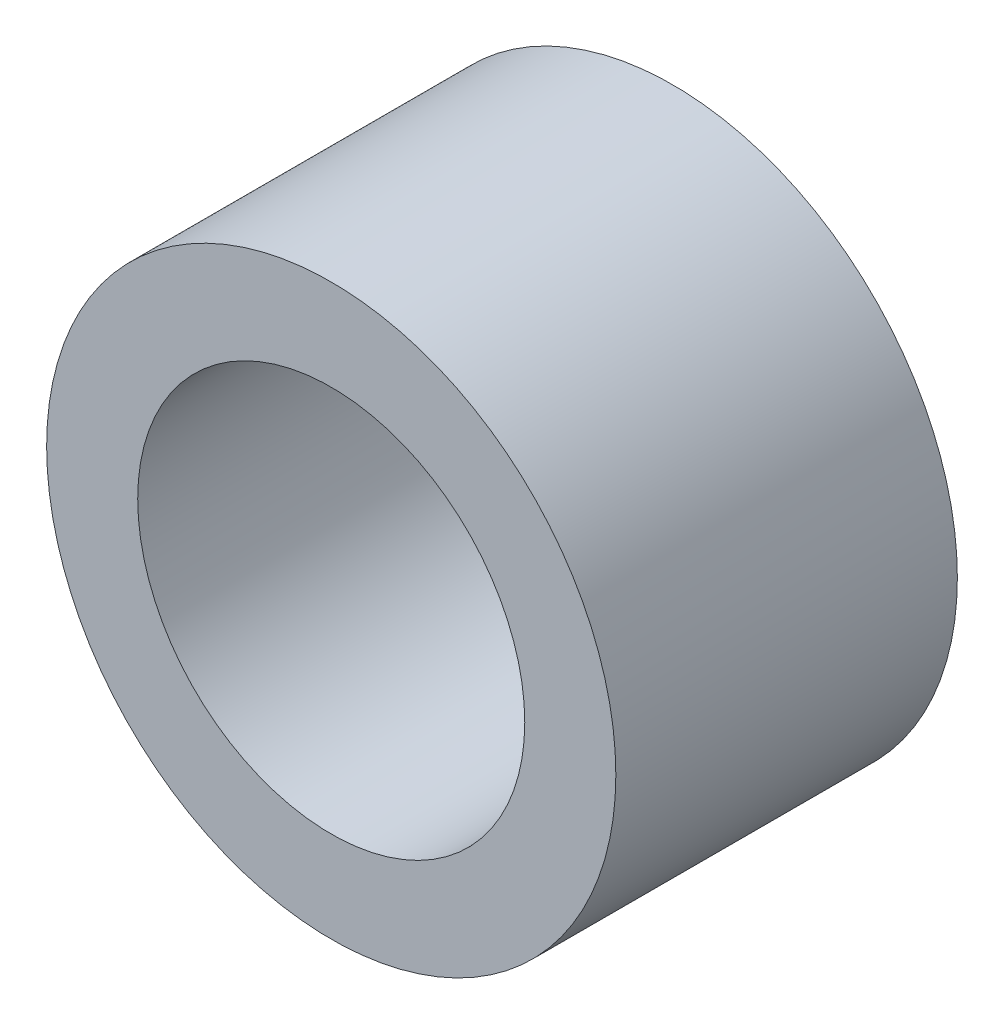
from build123d import *

# Parameters (mm, degrees)
SKETCH1_R               = 2.5
BOSS_EXTRUDE1_DEPTH     = 3
CUT_EXTRUDE1_DEPTH      = 5.636809248
CUT_EXTRUDE1_DEPTH_BACK = 5.636809248
SKETCH2_R               = 1.7


with BuildPart() as part:
    # Sketch1 → Boss-Extrude1 (new body)
    with BuildSketch(Plane(origin=(0, 0, 0), x_dir=(0, 1, 0), z_dir=(0, 0, 1))):
        with Locations(Location((0, 0, 0), (0, 0, 270))):
            Circle(SKETCH1_R)
    extrude(amount=BOSS_EXTRUDE1_DEPTH)

    # Sketch2 → Cut-Extrude1 (cut, two sides: drawn at the far end of the back side and taken through both)
    with BuildSketch(Plane.XY.offset(3).offset(-CUT_EXTRUDE1_DEPTH_BACK)):
        Circle(SKETCH2_R)
    extrude(amount=CUT_EXTRUDE1_DEPTH + CUT_EXTRUDE1_DEPTH_BACK, mode=Mode.SUBTRACT)


solid = part.part
